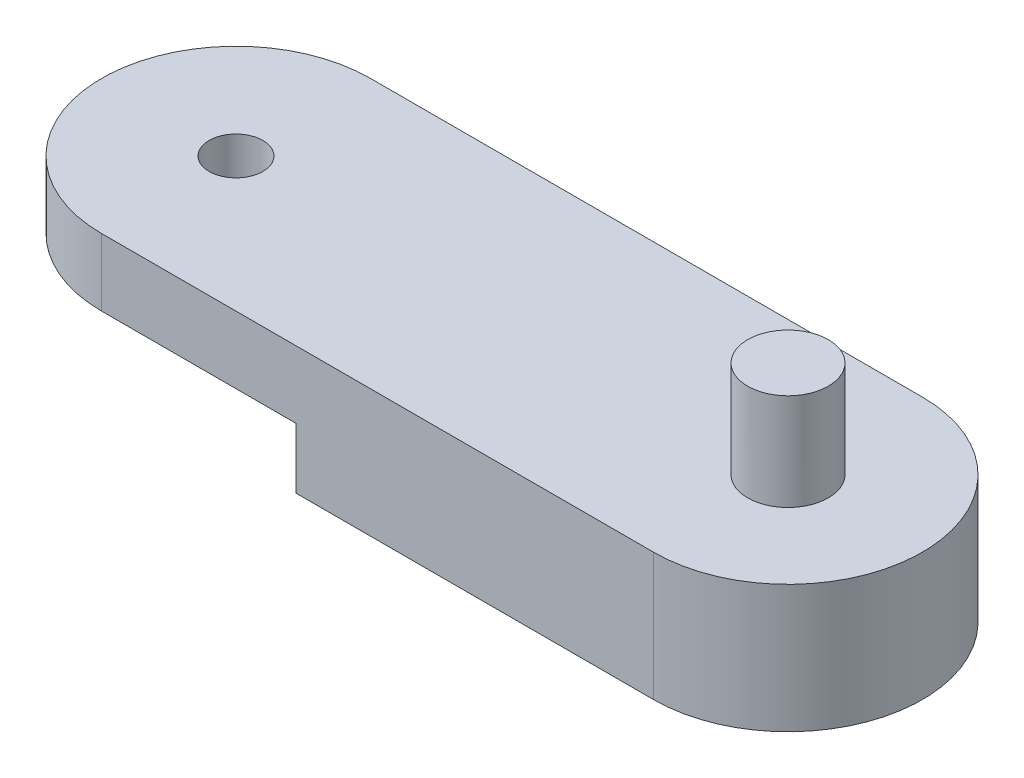
from build123d import *

# Parameters (mm, degrees)
SKETCH_1_R          = 2
EXTRUDE_1_DEPTH     = 5
SKETCH_2_R          = 3
EXTRUDE_2_DEPTH     = 10
EXTRUDE_START       = 4.5
EXTRUDE_3_DEPTH     = 4.5
CUT_EXTRUDE_1_DEPTH = 4.5
CUT_EXTRUDE_START   = -10
SKETCH_7_R          = 2
CUT_EXTRUDE_2_DEPTH = 10
SKETCH_8_R          = 2
CUT_EXTRUDE_3_DEPTH = 10
CUT_EXTRUDE_4_DEPTH = 6
SKETCH_10_W         = 23.139372947
SKETCH_10_H         = 31.36360791
CUT_EXTRUDE_7_DEPTH = 2.8


with BuildPart() as part:
    # 草图1 → 凸台-拉伸1 (new body)
    with BuildSketch(Plane(origin=(0, 0, 0), x_dir=(1, 0, 0), z_dir=(0, 1, 0))):
        with BuildLine():
            Line((0, 10), (100, 10))
            ThreePointArc((100, 10), (110, 0), (100, -10))
            Line((100, -10), (0, -10))
            ThreePointArc((0, -10), (-10, 0), (0, 10))
        make_face()
        with Locations(Location((0, 0, 0), (0, 0, 270))):
            Circle(SKETCH_1_R, mode=Mode.SUBTRACT)
    extrude(amount=EXTRUDE_1_DEPTH)

    # 草图2 → 凸台-拉伸2 (add)
    with BuildSketch(Plane(origin=(0, 5, 0), x_dir=(1, 0, 0), z_dir=(0, 1, 0))):
        with Locations(Location((100, 0, 0), (0, 0, 270))):
            Circle(SKETCH_2_R)
    extrude(amount=EXTRUDE_2_DEPTH)

    # 草图3 → 凸台-拉伸3 (add)
    with BuildSketch(Plane.XZ.offset(EXTRUDE_START)):
        with BuildLine():
            Line((100, 10), (73.40776322, 10))
            Line((73.40776322, 10), (73.40776322, -10))
            Line((73.40776322, -10), (100, -10))
            ThreePointArc((100, -10), (110, 0), (100, 10))
        make_face()
    extrude(amount=-EXTRUDE_3_DEPTH)

    # 草图4 → 切除-拉伸1 (cut)
    with BuildSketch(Plane.XZ.offset(4.5)):
        with BuildLine():
            Line((79.849230428, 2.288593229), (99.690178504, 3.236180981))
            ThreePointArc((99.690178504, 3.236180981), (103.250977807, 0), (99.690178504, -3.236180981))
            Line((99.690178504, -3.236180981), (79.849230428, -2.288593229))
            ThreePointArc((79.849230428, -2.288593229), (77.560637199, 0), (79.849230428, 2.288593229))
        make_face()
    extrude(amount=-CUT_EXTRUDE_1_DEPTH, mode=Mode.SUBTRACT)

    # 草图7 → 切除-拉伸2 (cut)
    with BuildSketch(Plane(origin=(0, 5, 0), x_dir=(1, 0, 0), z_dir=(0, 1, 0)).offset(CUT_EXTRUDE_START)):
        with BuildLine():
            ThreePointArc((58.924703642, -10), (48.924703642, 0), (58.924703642, 10))
            Line((58.924703642, 10), (0, 10))
            ThreePointArc((0, 10), (-10, 0), (0, -10))
            Line((0, -10), (58.924703642, -10))
        make_face()
        Circle(SKETCH_7_R, mode=Mode.SUBTRACT)
    extrude(amount=CUT_EXTRUDE_2_DEPTH, mode=Mode.SUBTRACT)

    # 草图8 → 切除-拉伸3 (cut)
    with BuildSketch(Plane(origin=(0, 5, 0), x_dir=(1, 0, 0), z_dir=(0, 1, 0))):
        with Locations(Location((58.924703642, 0, 0), (0, 0, 270))):
            Circle(SKETCH_8_R)
    extrude(amount=-CUT_EXTRUDE_3_DEPTH, mode=Mode.SUBTRACT)

    # 草图9 → 切除-拉伸4 (cut)
    with BuildSketch(Plane.XZ.offset(4.5)):
        with BuildLine():
            Line((79.849230428, 2.288593229), (99.378953737, 4.81012209))
            ThreePointArc((99.378953737, 4.81012209), (104.850048761, 0), (99.378953737, -4.81012209))
            Line((99.378953737, -4.81012209), (79.849230428, -2.288593229))
            ThreePointArc((79.849230428, -2.288593229), (77.560637199, 0), (79.849230428, 2.288593229))
        make_face()
    extrude(amount=-CUT_EXTRUDE_4_DEPTH, mode=Mode.SUBTRACT)

    # 草图10 → 切除-拉伸7 (cut)
    with BuildSketch(Plane(origin=(0, 15, 0), x_dir=(1, 0, 0), z_dir=(0, 1, 0))):
        with Locations((93.670893517, -8.00991687)):
            Rectangle(SKETCH_10_W, SKETCH_10_H)
    extrude(amount=-CUT_EXTRUDE_7_DEPTH, mode=Mode.SUBTRACT)


solid = part.part
